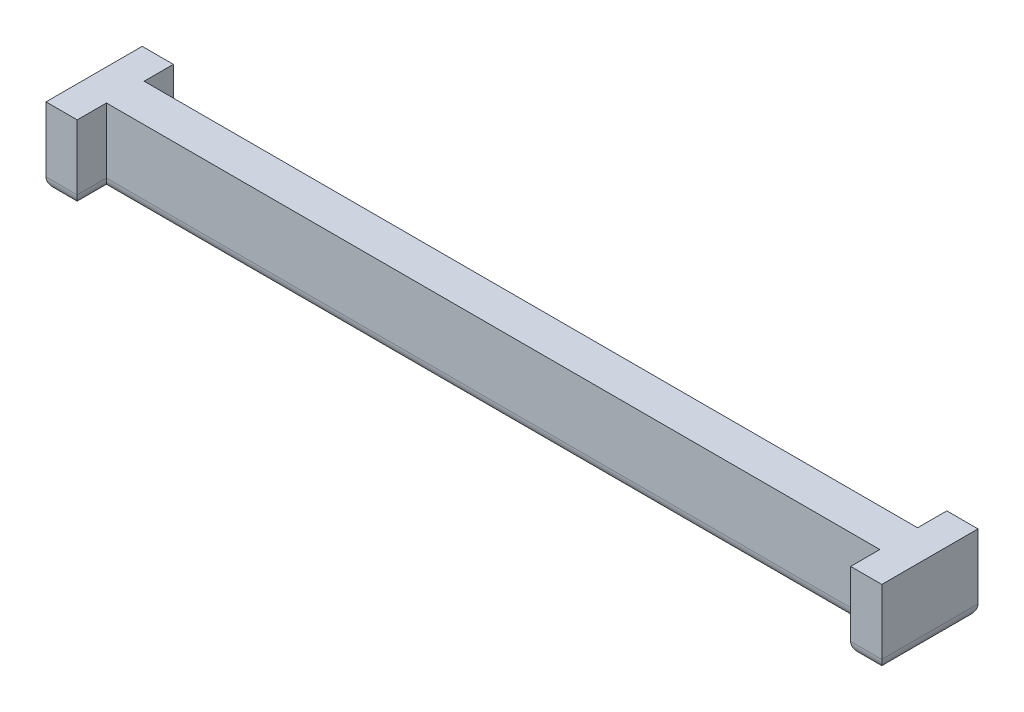
from build123d import *

# Parameters (mm, degrees)
BOSS_EXTRUDE1_DEPTH = 6
FILLET1_R           = 1


with BuildPart() as part:
    # Sketch1 → Boss-Extrude1 (new body)
    with BuildSketch(Plane(origin=(0, 0, 0), x_dir=(1, 0, 0), z_dir=(0, 1, 0))):
        Polygon((-29.75, 2.9), (29.75, 2.9), (29.75, 5.15), (32.15, 5.15), (32.15, -2.25), (29.75, -2.25), (29.75, 0), (-29.75, 0), (-29.75, -2.25), (-32.15, -2.25), (-32.15, 5.15), (-29.75, 5.15), align=None)
    extrude(amount=BOSS_EXTRUDE1_DEPTH)

    # Fillet1
    fillet1_edges = [part.edges().sort_by_distance(p)[0] for p in [
        (-30.95, 0, -5.15),
        (-32.15, 0, -1.45),
        (-30.95, 0, 2.25),
        (-29.75, 0, 1.125),
        (0, 0, 0),
        (29.75, 0, 1.125),
        (30.95, 0, 2.25),
        (32.15, 0, -1.45),
        (30.95, 0, -5.15),
        (29.75, 0, -4.025),
        (0, 0, -2.9),
        (-29.75, 0, -4.025),
    ]]
    fillet(fillet1_edges, radius=FILLET1_R)


solid = part.part
